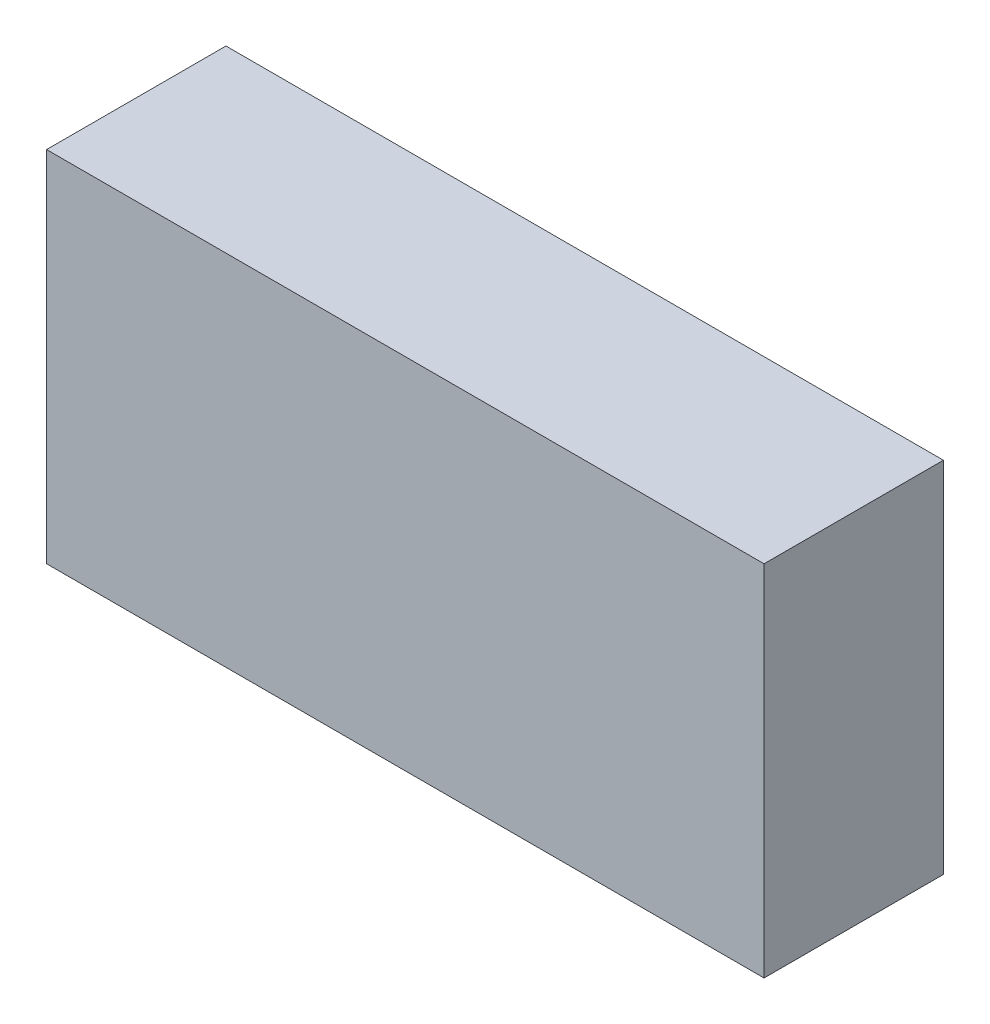
from build123d import *

# Parameters (mm, degrees)
SKETCH1_W           = 140
SKETCH1_H           = 70
BOSS_EXTRUDE1_DEPTH = 35


with BuildPart() as part:
    # Sketch1 → Boss-Extrude1 (new body)
    with BuildSketch(Plane.XY):
        with Locations((70, 35)):
            Rectangle(SKETCH1_W, SKETCH1_H)
    extrude(amount=BOSS_EXTRUDE1_DEPTH)


solid = part.part
